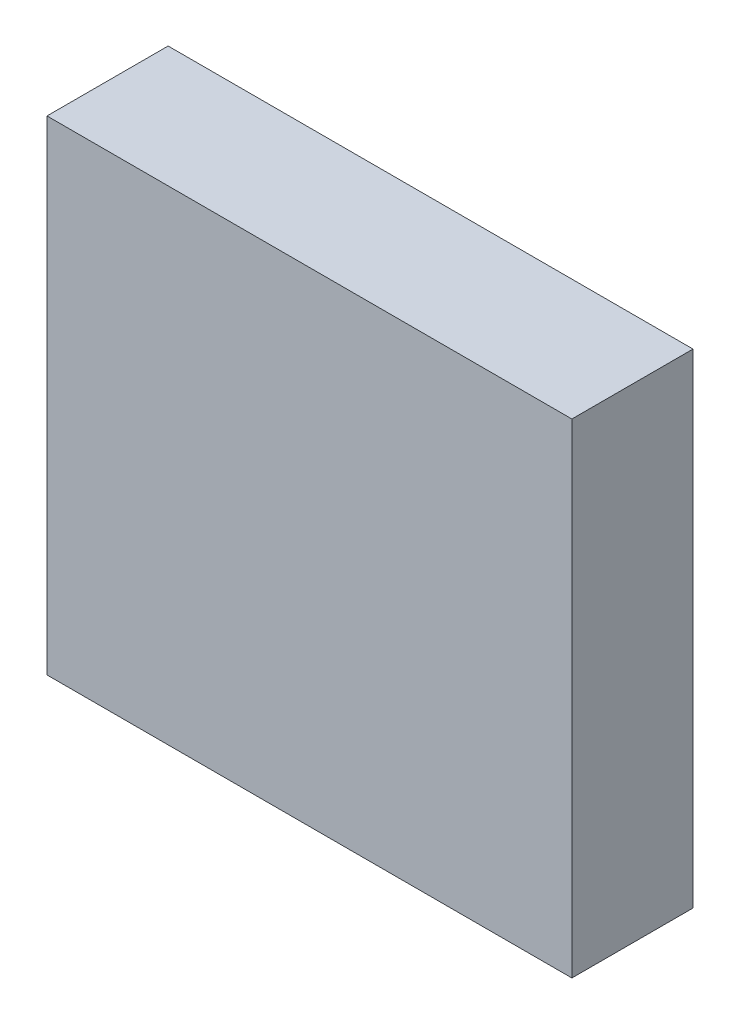
from build123d import *

# Parameters (mm, degrees)
SKETCH1_W           = 165.1
SKETCH1_H           = 152.27554
BOSS_EXTRUDE1_DEPTH = 38.1


with BuildPart() as part:
    # Sketch1 → Boss-Extrude1 (new body)
    with BuildSketch(Plane.XY):
        Rectangle(SKETCH1_W, SKETCH1_H)
    extrude(amount=BOSS_EXTRUDE1_DEPTH)


solid = part.part
